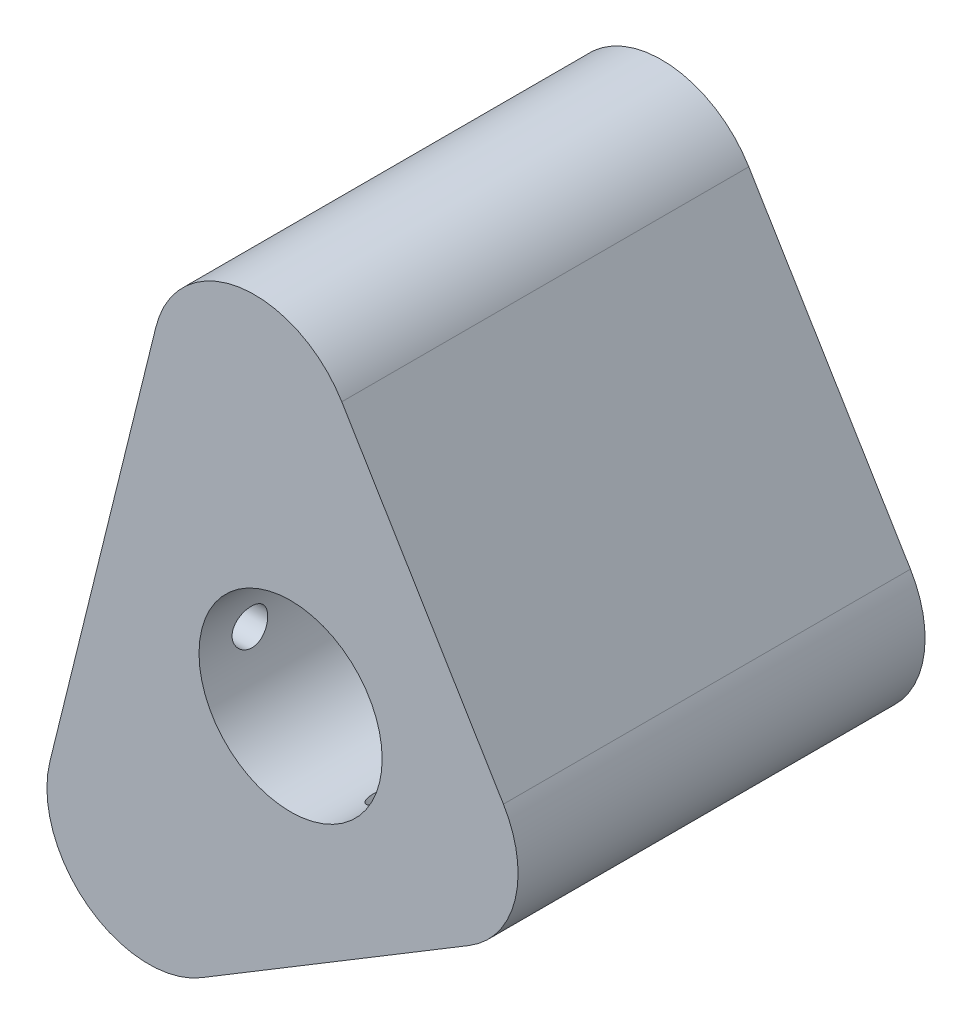
from build123d import *

# Parameters (mm, degrees)
SKETCH1_R               = 9
BOSS_EXTRUDE1_DEPTH     = 70
SKETCH2_R               = 2.5
CUT_EXTRUDE1_DEPTH      = 5
CUT_EXTRUDE2_REACH      = 90.987
CUT_EXTRUDE2_END_RADIUS = 9
SKETCH3_R               = 1.75
CIRPATTERN1_COUNT       = 3
SKETCH5_W               = 24.568161226
SKETCH5_H               = 25
SKETCH6_R               = 9
BOSS_EXTRUDE2_DEPTH     = 5
SKETCH8_R               = 9
BOSS_EXTRUDE3_DEPTH     = 3
CUT_EXTRUDE3_REACH      = 83.112
SKETCH9_R               = 1.875
SKETCH11_R              = 4
CUT_EXTRUDE4_DEPTH      = 3
CUT_EXTRUDE5_DEPTH      = 82.111701173
CUT_EXTRUDE5_DEPTH_BACK = 82.111701173
SKETCH12_W              = 65.170629785
SKETCH12_H              = 33.219663289
CUT_EXTRUDE6_REACH      = 89.673
CUT_EXTRUDE6_END_RADIUS = 9
SKETCH13_R              = 5


with BuildPart() as part:
    # Sketch1 → Boss-Extrude1 (new body)
    with BuildSketch(Plane.XY):
        with BuildLine():
            Line((-23.6546385, -16.539669722), (-13.23734813, 25.649078182))
            ThreePointArc((-13.23734813, 25.649078182), (-5.029445343, 33.138647287), (5.031042671, 28.421667909))
            Line((5.031042671, 28.421667909), (20.916771438, 2.118648772))
            ThreePointArc((20.916771438, 2.118648772), (22.065215706, -5.448366461), (17.526600651, -11.611126974))
            Line((17.526600651, -11.611126974), (-8.776418486, -27.496855741))
            ThreePointArc((-8.776418486, -27.496855741), (-19.876207308, -26.988917124), (-23.6546385, -16.539669722))
        make_face()
        Circle(SKETCH1_R, mode=Mode.SUBTRACT)
    extrude(amount=BOSS_EXTRUDE1_DEPTH)

    # Sketch2 → Cut-Extrude1 (cut)
    with BuildSketch(Plane(origin=(9.822624711, -16.263949206, 0), x_dir=(0.8559973266359324, 0.5169802479709809, 0), z_dir=(0.5169802479709809, -0.8559973266359324, 0))):
        with Locations((0, 65)):
            Circle(SKETCH2_R)
    cut_extrude1 = extrude(amount=-CUT_EXTRUDE1_DEPTH, mode=Mode.SUBTRACT)

    # Cut-Extrude2: up to this cylinder (the profile starts outside it)
    cut_extrude2_end = Plane(origin=(0, 0, 65), z_dir=(0, 0, -1)) * Cylinder(CUT_EXTRUDE2_END_RADIUS, 200.974, mode=Mode.PRIVATE)
    # Sketch3 → Cut-Extrude2 (cut, up to the surface)
    with BuildSketch(Plane(origin=(7.237723472, -11.983962573, 0), x_dir=(0.8559973266359324, 0.5169802479709809, 0), z_dir=(0.5169802479709809, -0.8559973266359324, 0)), mode=Mode.PRIVATE) as cut_extrude2_sk1:
        with Locations((0, 65)):
            Circle(SKETCH3_R)
    cut_extrude2_tool1 = extrude(cut_extrude2_sk1.sketch, amount=-CUT_EXTRUDE2_REACH, mode=Mode.PRIVATE) - cut_extrude2_end
    cut_extrude2 = cut_extrude2_tool1.solids().sort_by_distance((7.237723, -11.983963, 65))[0]
    add(cut_extrude2, mode=Mode.SUBTRACT)

    # CirPattern1: Cut-Extrude1, Cut-Extrude2 ×3 about axis
    cirpattern1_axis = Axis((0, 0, 0), (0, 0, 1))
    add([cut_extrude1.rotate(cirpattern1_axis, i * 360 / CIRPATTERN1_COUNT) for i in range(1, CIRPATTERN1_COUNT)], mode=Mode.SUBTRACT)
    add([cut_extrude2.rotate(cirpattern1_axis, i * 360 / CIRPATTERN1_COUNT) for i in range(1, CIRPATTERN1_COUNT)], mode=Mode.SUBTRACT)

    # Sketch5 → Cut-Revolve1 (revolve, cut)
    with BuildSketch(Plane(origin=(0, 0, 0), x_dir=(1, 0, 0), z_dir=(0, 1, 0)), mode=Mode.PRIVATE) as cut_revolve1_sk:
        with Locations((-12.284080613, -17.5)):
            Rectangle(SKETCH5_W, SKETCH5_H)
    revolve(cut_revolve1_sk.sketch.rotate(Axis((0, 0, 0), (0, 0, 1)), 180), axis=Axis((0, 0, 0), (0, 0, 1)), mode=Mode.SUBTRACT)

    # Sketch6 → Boss-Extrude2 (add)
    with BuildSketch(Plane(origin=(0, 0, 0), x_dir=(-1, 0, 0), z_dir=(0, 0, -1))):
        with Locations(Location((0, 0, 0), (0, 0, 180))):
            Circle(SKETCH6_R)
    extrude(amount=-BOSS_EXTRUDE2_DEPTH)

    # Sketch8 → Boss-Extrude3 (add)
    with BuildSketch(Plane(origin=(0, 0, 30), x_dir=(-1, 0, 0), z_dir=(0, 0, -1))):
        Circle(SKETCH8_R)
    extrude(amount=-BOSS_EXTRUDE3_DEPTH)

    # Sketch9 → Cut-Extrude3 (cut, up to next)
    with BuildSketch(Plane(origin=(0, 0, 0), x_dir=(-1, 0, 0), z_dir=(0, 0, -1)), mode=Mode.PRIVATE) as cut_extrude3_sk1:
        with Locations((0, 8)):
            Circle(SKETCH9_R)
    cut_extrude3_tool1 = extrude(cut_extrude3_sk1.sketch, amount=-CUT_EXTRUDE3_REACH, mode=Mode.PRIVATE) & part.part
    # Sketch9 → Cut-Extrude3 (cut, up to next)
    with BuildSketch(Plane(origin=(0, 0, 0), x_dir=(-1, 0, 0), z_dir=(0, 0, -1)), mode=Mode.PRIVATE) as cut_extrude3_sk2:
        with Locations((8, 0)):
            Circle(SKETCH9_R)
    cut_extrude3_tool2 = extrude(cut_extrude3_sk2.sketch, amount=-CUT_EXTRUDE3_REACH, mode=Mode.PRIVATE) & part.part
    # Sketch9 → Cut-Extrude3 (cut, up to next)
    with BuildSketch(Plane(origin=(0, 0, 0), x_dir=(-1, 0, 0), z_dir=(0, 0, -1)), mode=Mode.PRIVATE) as cut_extrude3_sk3:
        with Locations((0, -8)):
            Circle(SKETCH9_R)
    cut_extrude3_tool3 = extrude(cut_extrude3_sk3.sketch, amount=-CUT_EXTRUDE3_REACH, mode=Mode.PRIVATE) & part.part
    # Sketch9 → Cut-Extrude3 (cut, up to next)
    with BuildSketch(Plane(origin=(0, 0, 0), x_dir=(-1, 0, 0), z_dir=(0, 0, -1)), mode=Mode.PRIVATE) as cut_extrude3_sk4:
        with Locations((-8, 0)):
            Circle(SKETCH9_R)
    cut_extrude3_tool4 = extrude(cut_extrude3_sk4.sketch, amount=-CUT_EXTRUDE3_REACH, mode=Mode.PRIVATE) & part.part
    add(cut_extrude3_tool1.solids().sort_by_distance((0, 8, 0))[0], mode=Mode.SUBTRACT)
    add(cut_extrude3_tool2.solids().sort_by_distance((-8, 0, 0))[0], mode=Mode.SUBTRACT)
    add(cut_extrude3_tool3.solids().sort_by_distance((0, -8, 0))[0], mode=Mode.SUBTRACT)
    add(cut_extrude3_tool4.solids().sort_by_distance((8, 0, 0))[0], mode=Mode.SUBTRACT)

    # Sketch11 → Cut-Extrude4 (cut)
    with BuildSketch(Plane(origin=(0, 0, 0), x_dir=(-1, 0, 0), z_dir=(0, 0, -1))):
        Circle(SKETCH11_R)
    extrude(amount=-CUT_EXTRUDE4_DEPTH, mode=Mode.SUBTRACT)

    # Sketch12 → Cut-Extrude5 (cut, two sides: drawn at the far end of the back side and taken through both)
    with BuildSketch(Plane(origin=(0, 0, 0), x_dir=(1, 0, 0), z_dir=(0, 1, 0)).offset(-CUT_EXTRUDE5_DEPTH_BACK)):
        with Locations((1.843004816, -13.390168356)):
            Rectangle(SKETCH12_W, SKETCH12_H)
    extrude(amount=CUT_EXTRUDE5_DEPTH + CUT_EXTRUDE5_DEPTH_BACK, mode=Mode.SUBTRACT)

    # Cut-Extrude6: up to this cylinder (the profile starts outside it)
    cut_extrude6_end = Plane(origin=(0, 0, 38), z_dir=(0, 0, -1)) * Cylinder(CUT_EXTRUDE6_END_RADIUS, 198.346, mode=Mode.PRIVATE)
    # Sketch13 → Cut-Extrude6 (cut, up to the surface)
    with BuildSketch(Plane(origin=(-18.445993315, 4.55470423, 0), x_dir=(0, 0, 1), z_dir=(-0.9708417534216062, 0.23972127526204579, 0)), mode=Mode.PRIVATE) as cut_extrude6_sk1:
        with Locations(Location((38, 0, 0), (0, 0, 270))):
            Circle(SKETCH13_R)
    cut_extrude6_tool1 = extrude(cut_extrude6_sk1.sketch, amount=-CUT_EXTRUDE6_REACH, mode=Mode.PRIVATE) - cut_extrude6_end
    add(cut_extrude6_tool1.solids().sort_by_distance((-18.445993, 4.554704, 38))[0], mode=Mode.SUBTRACT)


solid = part.part
